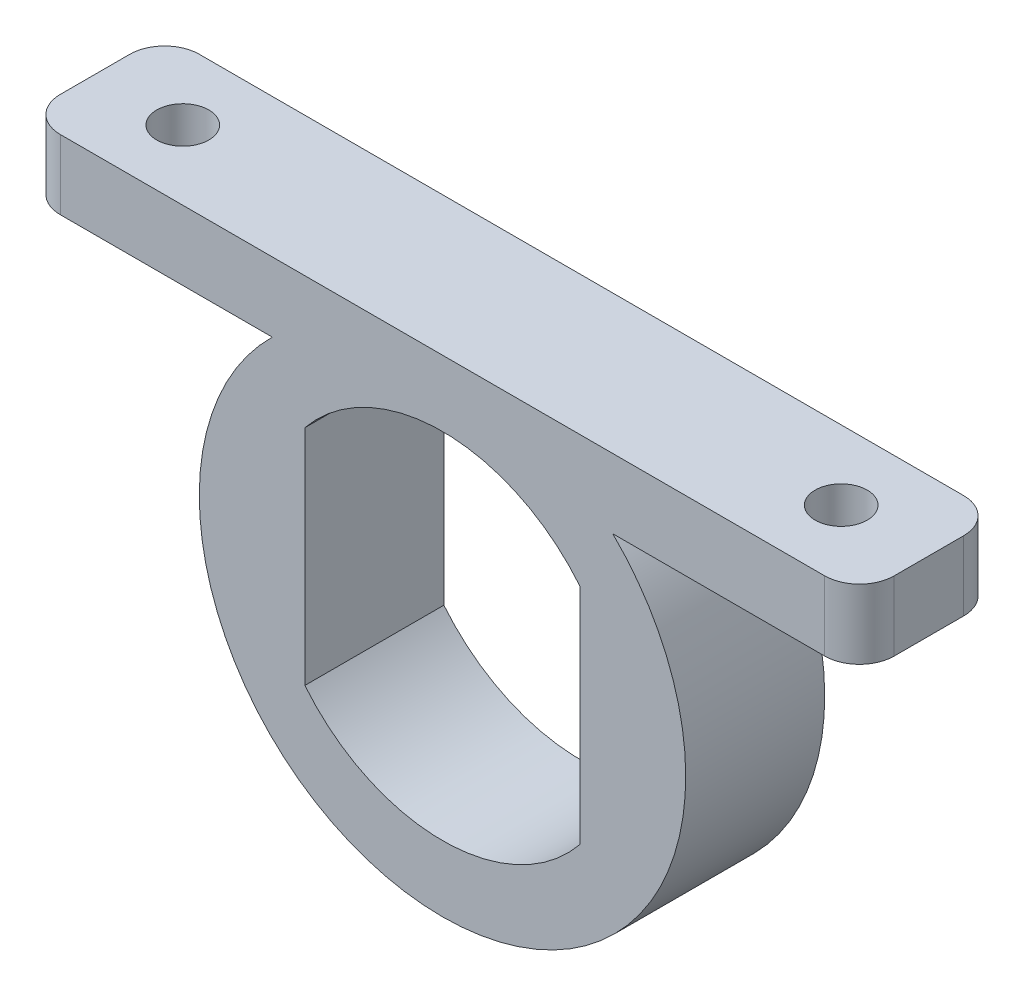
from build123d import *

# Parameters (mm, degrees)
SALIENTE_EXTRUIR1_DEPTH = 8
CORTAR_EXTRUIR1_DEPTH   = 29.91366459
REDONDEO1_R             = 2
CROQUIS3_R              = 1.5
CORTAR_EXTRUIR2_DEPTH   = 35.871191548


with BuildPart() as part:
    # Croquis1 → Saliente-Extruir1 (new body)
    with BuildSketch(Plane.XY):
        with BuildLine():
            Line((0, 14), (-24, 14))
            Line((-24, 14), (-24, 10))
            Line((-24, 10), (-9.797958971, 10))
            ThreePointArc((-9.797958971, 10), (0, -14), (9.797958971, 10))
            Line((9.797958971, 10), (24, 10))
            Line((24, 10), (24, 14))
            Line((24, 14), (0, 14))
        make_face()
    extrude(amount=SALIENTE_EXTRUIR1_DEPTH)

    # Croquis2 → Cortar-Extruir1 (cut, through all)
    with BuildSketch(Plane.XY.offset(8)):
        with BuildLine():
            Line((-7.922081482, 6.425), (-7.922081482, -6.425))
            ThreePointArc((-7.922081482, -6.425), (0, -10.2), (7.922081482, -6.425))
            Line((7.922081482, -6.425), (7.922081482, 6.425))
            ThreePointArc((7.922081482, 6.425), (0, 10.2), (-7.922081482, 6.425))
        make_face()
    extrude(amount=-CORTAR_EXTRUIR1_DEPTH, mode=Mode.SUBTRACT)

    # Redondeo1
    redondeo1_edges = [part.edges().sort_by_distance(p)[0] for p in [
        (-24, 12, 8),
        (24, 12, 8),
        (-24, 12, 0),
        (24, 12, 0),
    ]]
    fillet(redondeo1_edges, radius=REDONDEO1_R)

    # Croquis3 → Cortar-Extruir2 (cut, through all)
    with BuildSketch(Plane(origin=(0, 10, 0), x_dir=(-1, 0, 0), z_dir=(0, -1, 0))):
        with Locations(Location((18.949489743, -4, 0), (0, 0, 90))):
            Circle(CROQUIS3_R)
        with Locations(Location((-18.949489743, -4, 0), (0, 0, 90))):
            Circle(CROQUIS3_R)
    extrude(amount=-CORTAR_EXTRUIR2_DEPTH, mode=Mode.SUBTRACT)


solid = part.part
